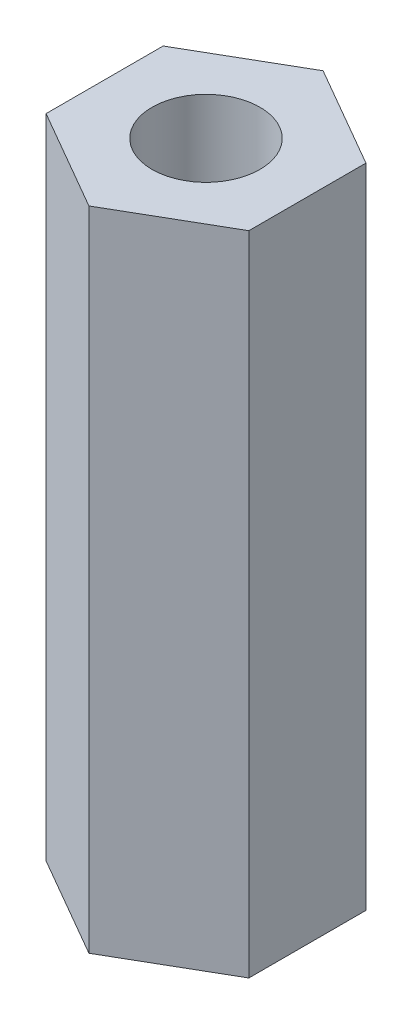
from build123d import *

# Parameters (mm, degrees)
SKETCH1_R           = 1.5
BOSS_EXTRUDE1_DEPTH = 6
BOSS_EXTRUDE2_DEPTH = 15
SKETCH3_R           = 1.25
CUT_EXTRUDE1_DEPTH  = 22.304596531
SKETCH4_R           = 1.753983447
CUT_EXTRUDE2_DEPTH  = 10


with BuildPart() as part:
    # Sketch1 → Boss-Extrude1 (new body)
    with BuildSketch(Plane(origin=(0, 0, 0), x_dir=(1, 0, 0), z_dir=(0, 1, 0))):
        with Locations(Location((0, 0, 0), (0, 0, 270))):
            Circle(SKETCH1_R)
    extrude(amount=BOSS_EXTRUDE1_DEPTH)

    # Sketch2 → Boss-Extrude2 (add)
    with BuildSketch(Plane(origin=(0, 6, 0), x_dir=(1, 0, 0), z_dir=(0, 1, 0))):
        Polygon((-2.35, 1.356773133), (-2.35, -1.356773133), (0, -2.713546265), (2.35, -1.356773133), (2.35, 1.356773133), (0, 2.713546265), align=None)
    extrude(amount=BOSS_EXTRUDE2_DEPTH)

    # Sketch3 → Cut-Extrude1 (cut, through all)
    with BuildSketch(Plane(origin=(0, 21, 0), x_dir=(1, 0, 0), z_dir=(0, 1, 0))):
        with Locations(Location((0, 0, 0), (0, 0, 270))):
            Circle(SKETCH3_R)
    extrude(amount=-CUT_EXTRUDE1_DEPTH, mode=Mode.SUBTRACT)

    # Sketch4 → Cut-Extrude2 (cut)
    with BuildSketch(Plane.XZ.offset(-6)):
        Circle(SKETCH4_R)
    extrude(amount=CUT_EXTRUDE2_DEPTH, mode=Mode.SUBTRACT)


solid = part.part
